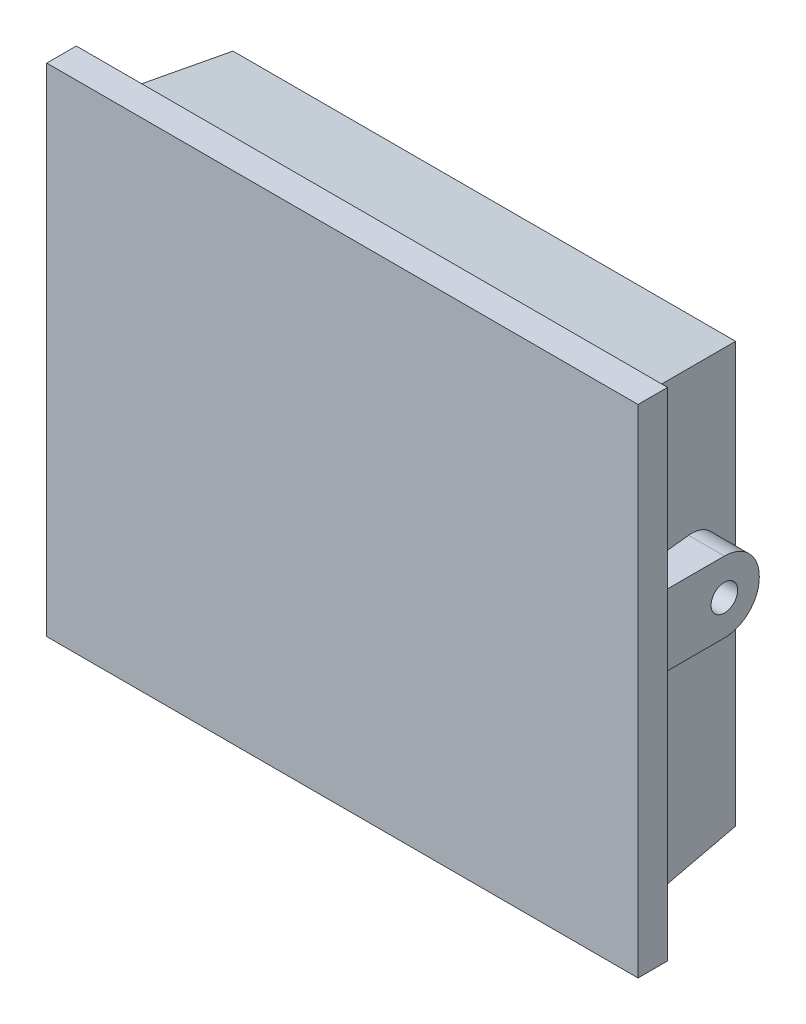
from build123d import *

# Parameters (mm, degrees)
CROQUIS1_W              = 100
CROQUIS1_H              = 84
SALIENTE_EXTRUIR1_DEPTH = 5
CROQUIS2_W              = 89
CROQUIS2_H              = 75
SALIENTE_EXTRUIR2_DEPTH = 19
SALIENTE_EXTRUIR2_TAPER = 6
CROQUIS3_R              = 2.25
SALIENTE_EXTRUIR3_DEPTH = 49.5


with BuildPart() as part:
    # Croquis1 → Saliente-Extruir1 (new body)
    with BuildSketch(Plane.XY):
        Rectangle(CROQUIS1_W, CROQUIS1_H)
    extrude(amount=SALIENTE_EXTRUIR1_DEPTH)

    # Croquis2 → Saliente-Extruir2 (add)
    with BuildSketch(Plane(origin=(0, 0, 0), x_dir=(-1, 0, 0), z_dir=(0, 0, -1))):
        Rectangle(CROQUIS2_W, CROQUIS2_H)
    extrude(amount=SALIENTE_EXTRUIR2_DEPTH, taper=SALIENTE_EXTRUIR2_TAPER)

    # Croquis3 → Saliente-Extruir3 (add, symmetric)
    with BuildSketch(Plane(origin=(0, 0, 0), x_dir=(0, 0, -1), z_dir=(1, 0, 0))):
        with BuildLine():
            Line((0, 12), (10.1, 12))
            ThreePointArc((10.1, 12), (14.271930009, 10.271930009), (16, 6.1))
            Line((16, 6.1), (16, 5.9))
            ThreePointArc((16, 5.9), (14.271930009, 1.728069991), (10.1, 0))
            Line((10.1, 0), (0, 0))
            Line((0, 0), (0, 12))
        make_face()
        with Locations(Location((10.1, 5.9, 0), (0, 0, 180))):
            Circle(CROQUIS3_R, mode=Mode.SUBTRACT)
    extrude(amount=SALIENTE_EXTRUIR3_DEPTH, both=True)


solid = part.part
